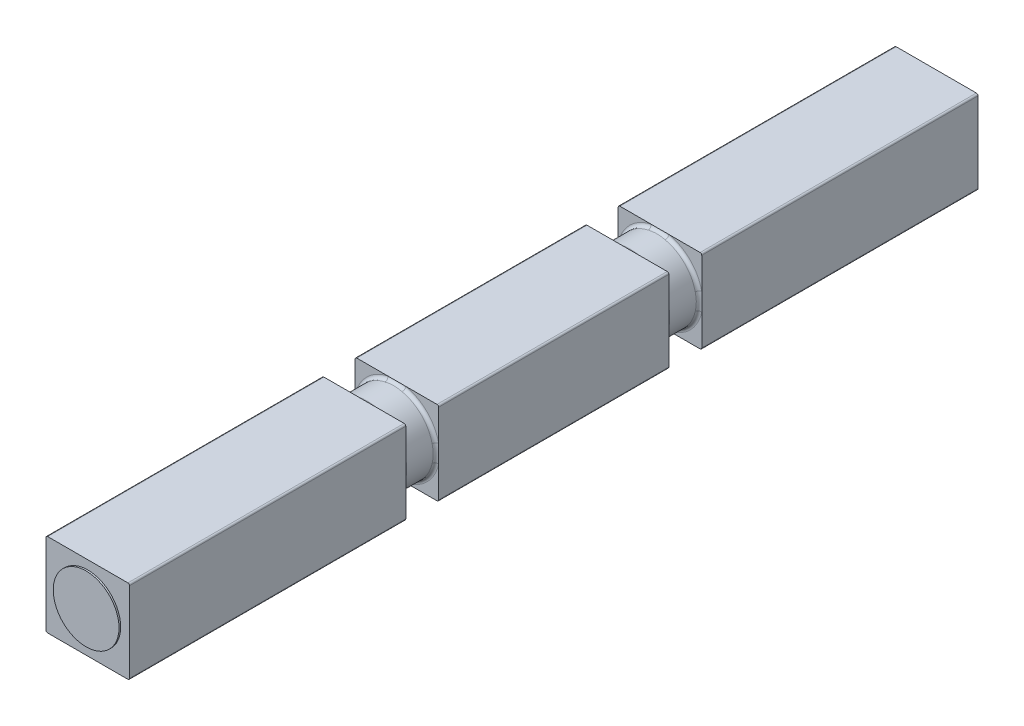
from build123d import *

# Parameters (mm, degrees)
SALIENTE_EXTRUIR1_DEPTH = 129
CROQUIS2_W              = 10
CROQUIS2_H              = 10
CROQUIS4_R              = 10
SALIENTE_EXTRUIR3_DEPTH = 0.5
REDONDEO1_R             = 1


with BuildPart() as part:
    # Croquis1 → Saliente-Extruir1 (new, symmetric)
    with BuildSketch(Plane.XY):
        with BuildLine():
            Line((-12.2, 12.7), (12.2, 12.7))
            ThreePointArc((12.2, 12.7), (12.553553391, 12.553553391), (12.7, 12.2))
            Line((12.7, 12.2), (12.7, -12.2))
            ThreePointArc((12.7, -12.2), (12.553553391, -12.553553391), (12.2, -12.7))
            Line((12.2, -12.7), (-12.2, -12.7))
            ThreePointArc((-12.2, -12.7), (-12.553553391, -12.553553391), (-12.7, -12.2))
            Line((-12.7, -12.2), (-12.7, 12.2))
            ThreePointArc((-12.7, 12.2), (-12.553553391, 12.553553391), (-12.2, 12.7))
        make_face()
    extrude(amount=SALIENTE_EXTRUIR1_DEPTH, both=True)

    # Croquis2 → Cortar-Revolución1 (revolve, cut)
    with BuildSketch(Plane(origin=(0, 0, 0), x_dir=(0, 0, -1), z_dir=(1, 0, 0)), mode=Mode.PRIVATE) as cortar_revoluci_n1_sk:
        with Locations((40, 17)):
            Rectangle(CROQUIS2_W, CROQUIS2_H)
        with Locations((-40, 17)):
            Rectangle(CROQUIS2_W, CROQUIS2_H)
    revolve(cortar_revoluci_n1_sk.sketch.rotate(Axis((0, 0, 0), (0, 0, -1)), 90), axis=Axis((0, 0, 0), (0, 0, -1)), mode=Mode.SUBTRACT)

    # Croquis4 → Saliente-Extruir3 (add)
    with BuildSketch(Plane.XY.offset(129)):
        Circle(CROQUIS4_R)
    saliente_extruir3 = extrude(amount=SALIENTE_EXTRUIR3_DEPTH)

    # Simetría1: Saliente-Extruir3 across plane
    add(saliente_extruir3.mirror(Plane.XY))

    # Redondeo1
    redondeo1_edges = [part.edges().sort_by_distance(p)[0] for p in [
        (-12, 0, 35),
        (-12, 0, 45),
        (-12, 0, -45),
        (-12, 0, -35),
    ]]
    fillet(redondeo1_edges, radius=REDONDEO1_R)


solid = part.part
